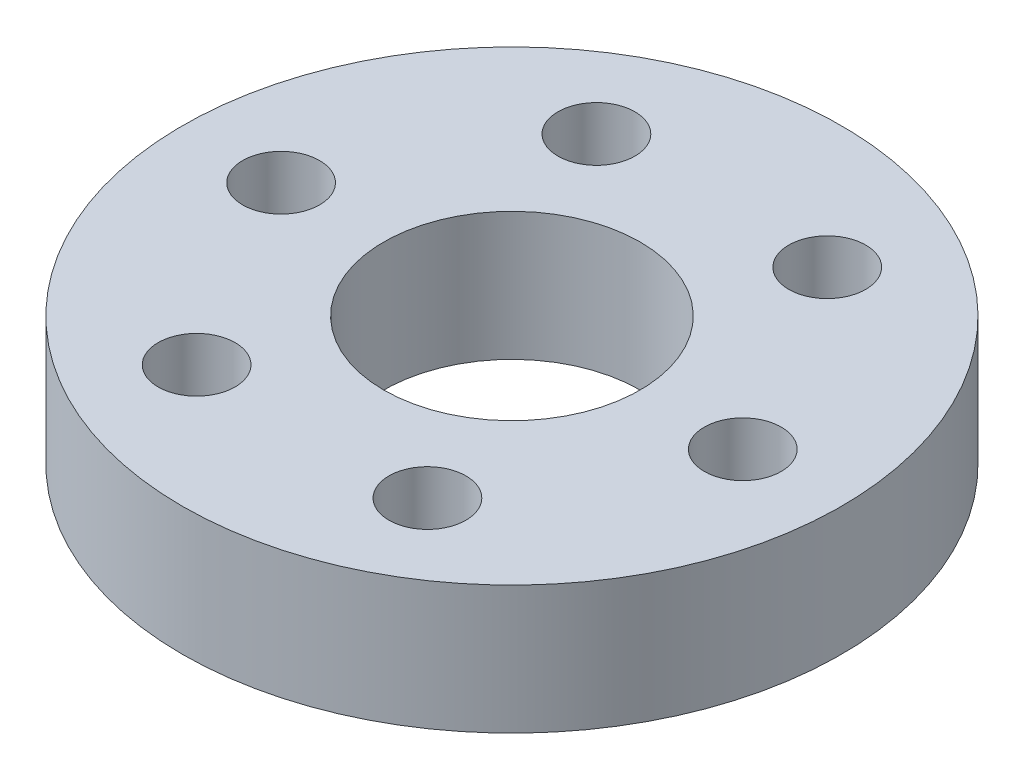
from build123d import *

# Parameters (mm, degrees)
SKETCH1_R             = 12.85
SKETCH1_R_2           = 1.5
SKETCH1_R_3           = 5
BOSS_EXTRUDE1_DEPTH   = 5
F_6_0MM_DOWEL_HOLE1_D = 3


with BuildPart() as part:
    # Sketch1 → Boss-Extrude1 (new body)
    with BuildSketch(Plane(origin=(0, 0, 0), x_dir=(1, 0, 0), z_dir=(0, 1, 0))):
        with Locations(Location((0, 0, 0), (0, 0, 270))):
            Circle(SKETCH1_R)
        with Locations(Location((4.5, 7.794228634, 0), (0, 0, 270))):
            Circle(SKETCH1_R_2, mode=Mode.SUBTRACT)
        with Locations(Location((-9, 0, 0), (0, 0, 270))):
            Circle(SKETCH1_R_2, mode=Mode.SUBTRACT)
        with Locations(Location((4.5, -7.794228634, 0), (0, 0, 270))):
            Circle(SKETCH1_R_2, mode=Mode.SUBTRACT)
        with Locations(Location((0, 0, 0), (0, 0, 270))):
            Circle(SKETCH1_R_3, mode=Mode.SUBTRACT)
    extrude(amount=BOSS_EXTRUDE1_DEPTH)

    # Ø6.0mm Dowel Hole1 (through all)
    with Locations(Plane(origin=(0, 5, 0), x_dir=(1, 0, 0), z_dir=(0, 1, 0))):
        with Locations((9, 0), (-4.5, 7.794228634), (-4.5, -7.794228634)):
            Hole(F_6_0MM_DOWEL_HOLE1_D / 2)


solid = part.part
